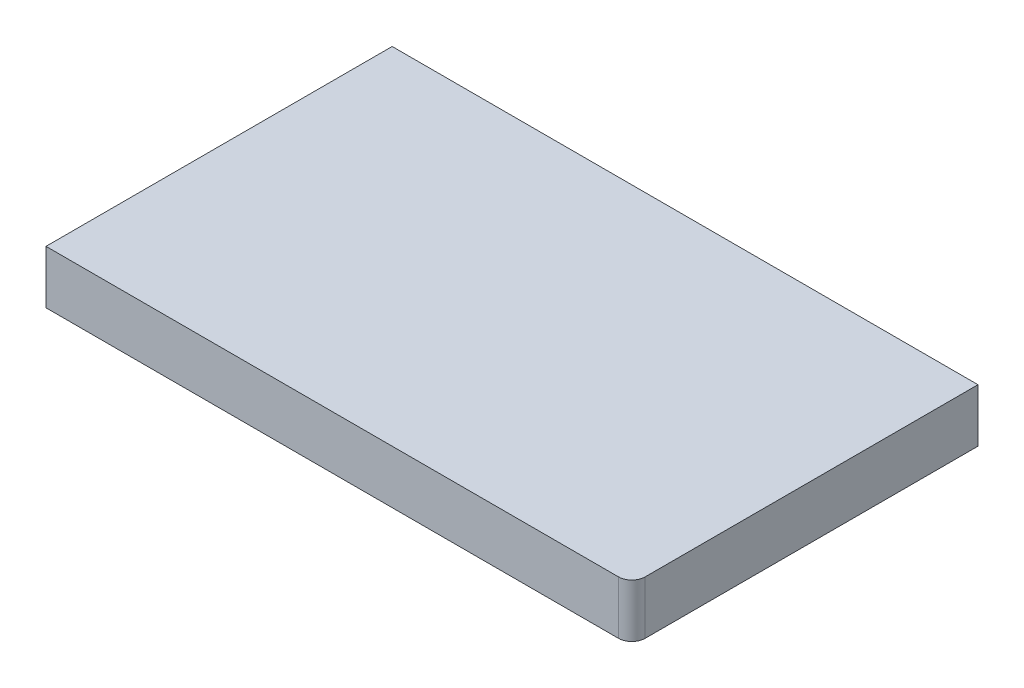
from build123d import *

# Parameters (mm, degrees)
SKETCH1_W           = 22
SKETCH1_H           = 13
BOSS_EXTRUDE1_DEPTH = 1
FILLET1_R           = 0.5


with BuildPart() as part:
    # Sketch1 → Boss-Extrude1 (new, symmetric)
    with BuildSketch(Plane(origin=(0, 0, 0), x_dir=(1, 0, 0), z_dir=(0, 1, 0))):
        Rectangle(SKETCH1_W, SKETCH1_H)
    extrude(amount=BOSS_EXTRUDE1_DEPTH, both=True)

    # Fillet1
    fillet1_edges = [part.edges().sort_by_distance(p)[0] for p in [
        (11, 0, 6.5),
    ]]
    fillet(fillet1_edges, radius=FILLET1_R)


solid = part.part
